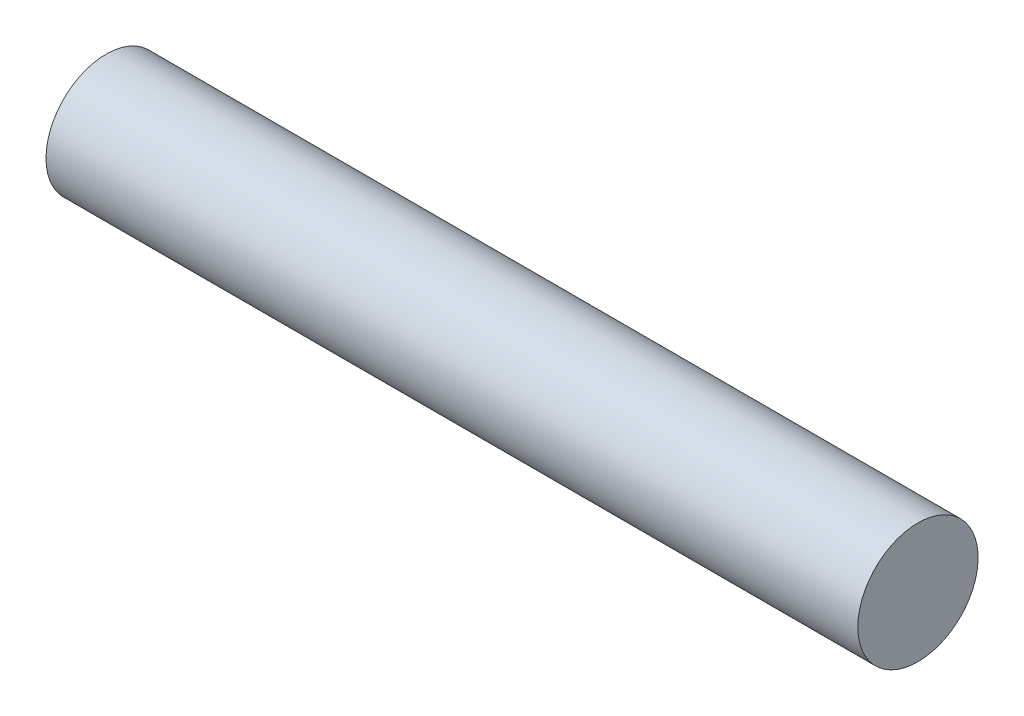
from build123d import *

# Parameters (mm, degrees)
SKETCH_1_W = 81
SKETCH_1_H = 6


with BuildPart() as part:
    # 草图1 → 旋转1 (revolve)
    with BuildSketch(Plane.XY, mode=Mode.PRIVATE) as revolve_1_sk:
        with Locations((40.5, 3)):
            Rectangle(SKETCH_1_W, SKETCH_1_H)
    revolve(revolve_1_sk.sketch.rotate(Axis((0, 0, 0), (1, 0, 0)), 90), axis=Axis((0, 0, 0), (1, 0, 0)))


solid = part.part
